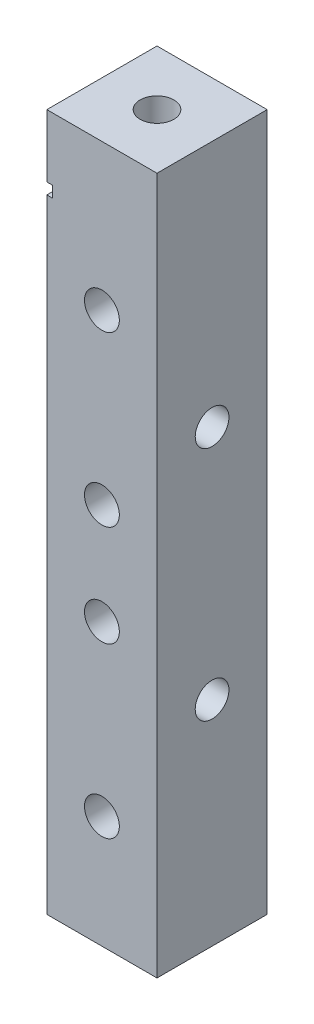
from build123d import *

# Parameters (mm, degrees)
SKETCH1_W      = 9.8
SKETCH1_H      = 9.8
EXTRUDE1_DEPTH = 62
SKETCH2_R      = 1.5
EXTRUDE2_DEPTH = 10
EXTRUDE3_START = -10
SKETCH3_R      = 1.5
EXTRUDE3_DEPTH = 10
SKETCH4_R      = 1.55
EXTRUDE4_DEPTH = 10
SKETCH5_R      = 1.5
EXTRUDE5_DEPTH = 10
SKETCH6_W      = 9.8
SKETCH6_H      = 1
EXTRUDE6_DEPTH = 0.5


with BuildPart() as part:
    # Sketch1 → Extrude1 (new body)
    with BuildSketch(Plane(origin=(0, 0, 0), x_dir=(1, 0, 0), z_dir=(0, 1, 0))):
        Rectangle(SKETCH1_W, SKETCH1_H)
    extrude(amount=EXTRUDE1_DEPTH)

    # Sketch2 → Extrude2 (cut)
    with BuildSketch(Plane.XZ):
        with Locations(Location((0, 0, 0), (0, 0, 270))):
            Circle(SKETCH2_R)
    extrude(amount=-EXTRUDE2_DEPTH, mode=Mode.SUBTRACT)

    # Sketch3 → Extrude3 (cut)
    with BuildSketch(Plane(origin=(0, 62, 0), x_dir=(1, 0, 0), z_dir=(0, 1, 0)).offset(EXTRUDE3_START)):
        with Locations(Location((0, 0, 0), (0, 0, 90))):
            Circle(SKETCH3_R)
    extrude(amount=EXTRUDE3_DEPTH, mode=Mode.SUBTRACT)

    # Sketch4 → Extrude4 (cut)
    with BuildSketch(Plane(origin=(0, 0, -4.9), x_dir=(-1, 0, 0), z_dir=(0, 0, -1))):
        with Locations((0, 10)):
            Circle(SKETCH4_R)
        with Locations((0, 49)):
            Circle(SKETCH4_R)
        with Locations((0, 34)):
            Circle(SKETCH4_R)
        with Locations((0, 25)):
            Circle(SKETCH4_R)
    extrude(amount=-EXTRUDE4_DEPTH, mode=Mode.SUBTRACT)

    # Sketch5 → Extrude5 (cut)
    with BuildSketch(Plane.ZY.offset(4.9)):
        with Locations((0, 40)):
            Circle(SKETCH5_R)
        with Locations((0, 19)):
            Circle(SKETCH5_R)
    extrude(amount=-EXTRUDE5_DEPTH, mode=Mode.SUBTRACT)

    # Sketch6 → Extrude6 (cut)
    with BuildSketch(Plane.ZY.offset(4.9)):
        with Locations((0, 55.927600584)):
            Rectangle(SKETCH6_W, SKETCH6_H)
    extrude(amount=-EXTRUDE6_DEPTH, mode=Mode.SUBTRACT)


solid = part.part
